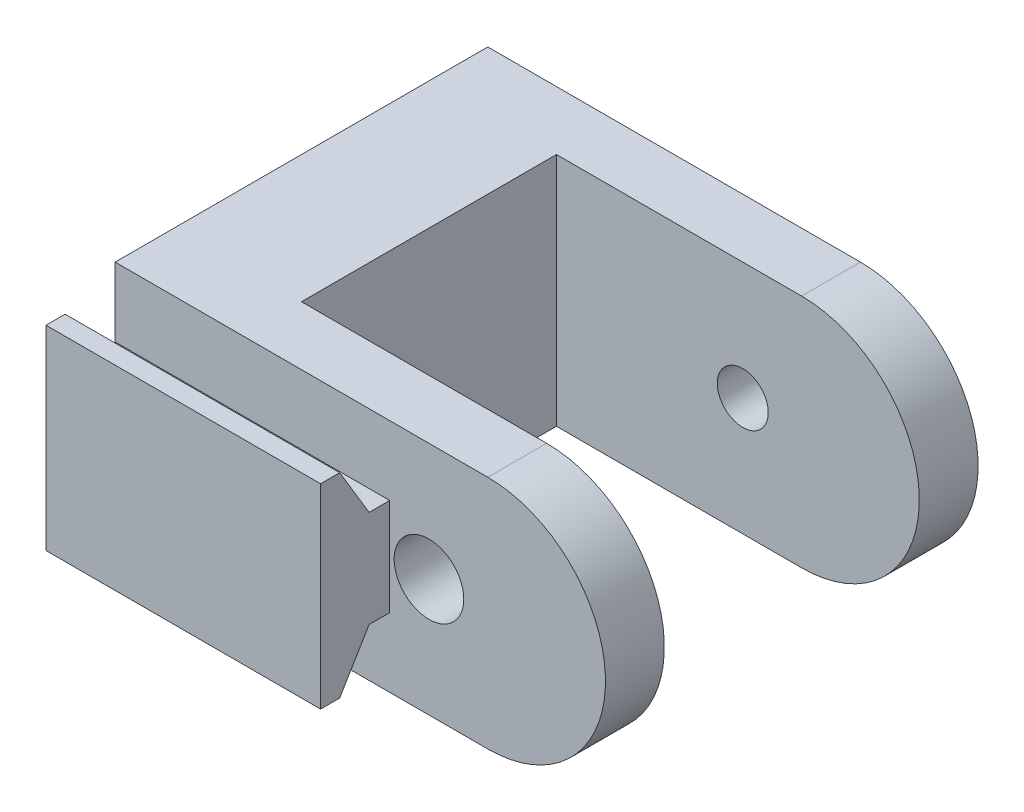
from build123d import *

# Parameters (mm, degrees)
BOSS_EXTRUDE1_DEPTH = 24
SKETCH3_R           = 2.6
CUT_EXTRUDE1_DEPTH  = 60
SKETCH5_R           = 3.55
CUT_EXTRUDE2_DEPTH  = 10
BOSS_EXTRUDE2_DEPTH = 28


with BuildPart() as part:
    # Sketch1 → Boss-Extrude1 (new body)
    with BuildSketch(Plane(origin=(0, 0, 0), x_dir=(1, 0, 0), z_dir=(0, 1, 0))):
        Polygon((0, 0), (50, 0), (50, 6), (13, 6), (13, 32), (50, 32), (50, 38), (0, 38), align=None)
    extrude(amount=BOSS_EXTRUDE1_DEPTH)

    # Sketch3 → Cut-Extrude1 (cut)
    with BuildSketch(Plane(origin=(0, 0, -38), x_dir=(-1, 0, 0), z_dir=(0, 0, -1))):
        with BuildLine():
            Line((-38, 24), (-50, 24))
            Line((-50, 24), (-50, 12))
            ThreePointArc((-50, 12), (-46.485281374, 20.485281374), (-38, 24))
        make_face()
        with BuildLine():
            ThreePointArc((-38, 0), (-46.485281374, 3.514718626), (-50, 12))
            Line((-50, 12), (-50, 0))
            Line((-50, 0), (-38, 0))
        make_face()
        with Locations((-32, 12)):
            Circle(SKETCH3_R)
    extrude(amount=-CUT_EXTRUDE1_DEPTH, mode=Mode.SUBTRACT)

    # Sketch5 → Cut-Extrude2 (cut)
    with BuildSketch(Plane.XY):
        with Locations((32, 12)):
            Circle(SKETCH5_R)
    extrude(amount=-CUT_EXTRUDE2_DEPTH, mode=Mode.SUBTRACT)

    # Sketch7 → Boss-Extrude2 (add)
    with BuildSketch(Plane.ZY):
        Polygon((0, 16.95), (2.1, 16.95), (5.1, 21.95), (7.05, 21.95), (7.05, 2.05), (5.1, 2.05), (2.1, 7.05), (0, 7.05), align=None)
    extrude(amount=-BOSS_EXTRUDE2_DEPTH)


solid = part.part
